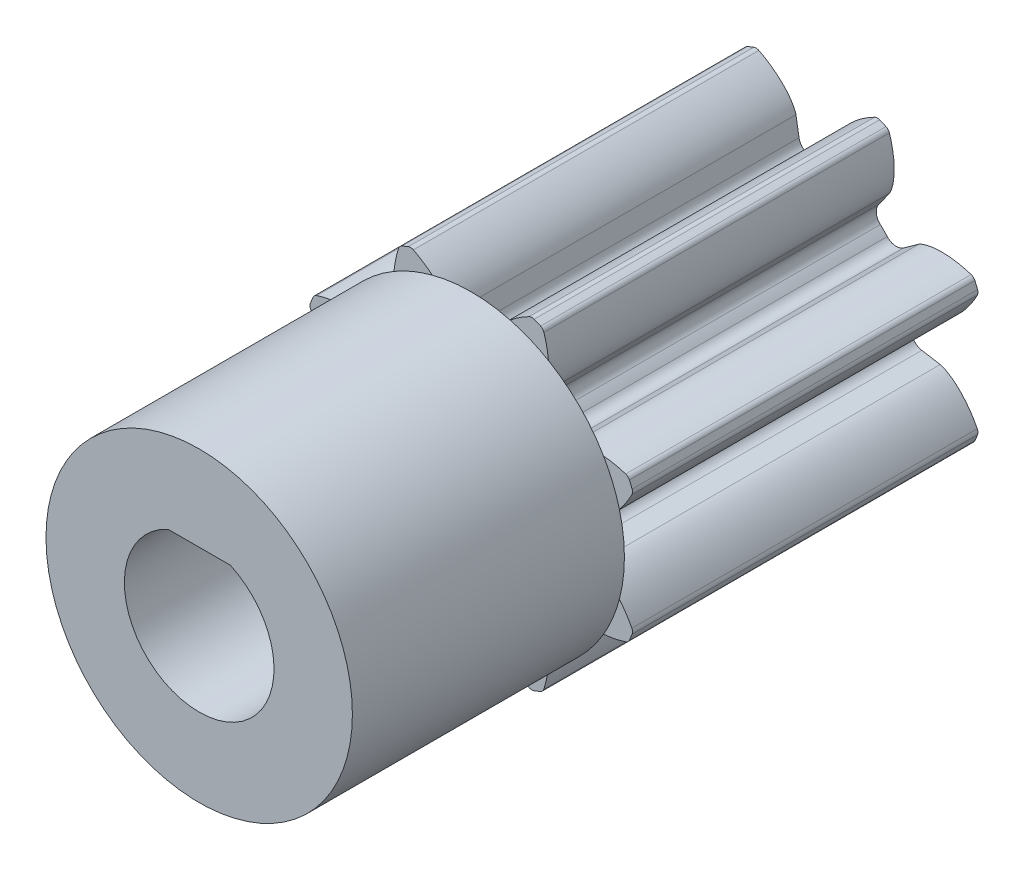
from build123d import *

# Parameters (mm, degrees)
SKETCH1_R                                 = 6.35
BOSS_EXTRUDE1_DEPTH                       = 12.7
CUT_EXTRUDE_DCLTBC_DEPTH                  = 16.554259867
FILLET_TIP_DCLTBC_R                       = 0.225840649
FILLET_ROOT_DCLTBC_R                      = 0.451681298
CIRPATTERN_DCLTBC_COUNT                   = 8
FILLET_TIP_DCLTBC_OF_CIRPATTERN_DCLTBC_R  = 0.225840649
FILLET_ROOT_DCLTBC_OF_CIRPATTERN_DCLTBC_R = 0.451681298
SKETCH4_R                                 = 5.63194408
BOSS_EXTRUDE2_DEPTH                       = 10
CUT_EXTRUDE1_DEPTH                        = 25.199542688


with BuildPart() as part:
    # Sketch1 → Boss-Extrude1 (new body)
    with BuildSketch(Plane.XY):
        Circle(SKETCH1_R)
    extrude(amount=BOSS_EXTRUDE1_DEPTH)

    # DCLTBC → Cut-Extrude-DCLTBC (cut, through all)
    with BuildSketch(Plane.XY):
        with BuildLine():
            Line((-0.762465098, 4.540469586), (-0.578384918, 3.444274544))
            ThreePointArc((-0.578384918, 3.444274544), (0, 3.4925), (0.578384918, 3.444274544))
            Line((0.578384918, 3.444274544), (0.762465098, 4.540469586))
            add(Edge.make_bspline(
                [(0.762465098, 4.540469586), (0.763034569, 4.543488036), (0.764819237, 4.551916605), (0.76893175, 4.567695247), (0.776679583, 4.593170604), (0.788064453, 4.625194838), (0.804494842, 4.666017173), (0.826031097, 4.713311361), (0.851950921, 4.764372266), (0.882541397, 4.81885718), (0.915143498, 4.872208333), (0.949571882, 4.924436701), (0.985567444, 4.975533126), (1.031137898, 5.036269094), (1.088495994, 5.107448593), (1.159378781, 5.188095877), (1.244219696, 5.276436139), (1.335260486, 5.362928889), (1.428549343, 5.445061504), (1.526869968, 5.524445472), (1.624871525, 5.598686298), (1.730580349, 5.671902497), (1.830170937, 5.737514811), (1.945834506, 5.80652891), (2.040393727, 5.860925157), (2.141307776, 5.913254628), (2.190891549, 5.938148554), (2.216425711, 5.950626611)],
                knots=[0, 0, 0, 0, 0, 0.005376748, 0.015083688, 0.02853182, 0.046610139, 0.064854849, 0.092110525, 0.119476175, 0.146842495, 0.174208853, 0.201574955, 0.228941013, 0.256307345, 0.307035032, 0.361767351, 0.41649966, 0.471231936, 0.525964281, 0.580696615, 0.635428982, 0.690161387, 0.744893688, 0.799626083, 0.854358408, 0.909090916, 0.909090916, 0.909090916, 0.909090916, 0.909090916], degree=4))
            ThreePointArc((2.216425711, 5.950626611), (0, 6.35), (-2.216425711, 5.950626611))
            add(Edge.make_bspline(
                [(-0.762465098, 4.540469586), (-0.763034569, 4.543488036), (-0.764819237, 4.551916605), (-0.76893175, 4.567695247), (-0.776679583, 4.593170604), (-0.788064453, 4.625194838), (-0.804494842, 4.666017173), (-0.826031097, 4.713311361), (-0.851950921, 4.764372266), (-0.882541397, 4.81885718), (-0.915143498, 4.872208333), (-0.949571882, 4.924436701), (-0.985567444, 4.975533126), (-1.031137898, 5.036269094), (-1.088495994, 5.107448593), (-1.159378781, 5.188095877), (-1.244219696, 5.276436139), (-1.335260486, 5.362928889), (-1.428549343, 5.445061504), (-1.526869968, 5.524445472), (-1.624871525, 5.598686298), (-1.730580349, 5.671902497), (-1.830170937, 5.737514811), (-1.945834506, 5.80652891), (-2.040393727, 5.860925157), (-2.141307776, 5.913254628), (-2.190891549, 5.938148554), (-2.216425711, 5.950626611)],
                knots=[0, 0, 0, 0, 0, 0.005376748, 0.015083688, 0.02853182, 0.046610139, 0.064854849, 0.092110525, 0.119476175, 0.146842495, 0.174208853, 0.201574955, 0.228941013, 0.256307345, 0.307035032, 0.361767351, 0.41649966, 0.471231936, 0.525964281, 0.580696615, 0.635428982, 0.690161387, 0.744893688, 0.799626083, 0.854358408, 0.909090916, 0.909090916, 0.909090916, 0.909090916, 0.909090916], degree=4))
        make_face()
    cut_extrude_dcltbc = extrude(amount=CUT_EXTRUDE_DCLTBC_DEPTH, mode=Mode.SUBTRACT)

    # Fillet-Tip-DCLTBC
    fillet_tip_dcltbc_edges = [part.edges().sort_by_distance(p)[0] for p in [
        (2.216425711, 5.950626611, 6.35),
        (-2.216425711, 5.950626611, 6.35),
    ]]
    fillet(fillet_tip_dcltbc_edges, radius=FILLET_TIP_DCLTBC_R)

    # Fillet-Root-DCLTBC
    fillet_root_dcltbc_edges = [part.edges().sort_by_distance(p)[0] for p in [
        (0.578384918, 3.444274544, 6.35),
        (-0.578384918, 3.444274544, 6.35),
    ]]
    fillet(fillet_root_dcltbc_edges, radius=FILLET_ROOT_DCLTBC_R)

    # CirPattern-DCLTBC: Cut-Extrude-DCLTBC ×8 about axis
    cirpattern_dcltbc_axis = Axis((0, 0, 12.7), (0, 0, 1))
    for i in range(1, CIRPATTERN_DCLTBC_COUNT):
        add(cut_extrude_dcltbc.rotate(cirpattern_dcltbc_axis, i * 360 / CIRPATTERN_DCLTBC_COUNT), mode=Mode.SUBTRACT)

    # Fillet-Tip-DCLTBC of CirPattern-DCLTBC
    fillet_tip_dcltbc_of_cirpattern_dcltbc_edges = [part.edges().sort_by_distance(p)[0] for p in [
        (-2.640478779, 5.77497808, 6.35),
        (-5.77497808, 2.640478779, 6.35),
        (-5.950626611, 2.216425711, 6.35),
        (-5.950626611, -2.216425711, 6.35),
        (-5.77497808, -2.640478779, 6.35),
        (-2.640478779, -5.77497808, 6.35),
        (-2.216425711, -5.950626611, 6.35),
        (2.216425711, -5.950626611, 6.35),
        (2.640478779, -5.77497808, 6.35),
        (5.77497808, -2.640478779, 6.35),
        (5.950626611, -2.216425711, 6.35),
        (5.950626611, 2.216425711, 6.35),
        (5.77497808, 2.640478779, 6.35),
        (2.640478779, 5.77497808, 6.35),
    ]]
    fillet(fillet_tip_dcltbc_of_cirpattern_dcltbc_edges, radius=FILLET_TIP_DCLTBC_OF_CIRPATTERN_DCLTBC_R)

    # Fillet-Root-DCLTBC of CirPattern-DCLTBC
    fillet_root_dcltbc_of_cirpattern_dcltbc_edges = [part.edges().sort_by_distance(p)[0] for p in [
        (-2.026489989, 2.844449784, 6.35),
        (-2.844449784, 2.026489989, 6.35),
        (-3.444274544, 0.578384918, 6.35),
        (-3.444274544, -0.578384918, 6.35),
        (-2.844449784, -2.026489989, 6.35),
        (-2.026489989, -2.844449784, 6.35),
        (-0.578384918, -3.444274544, 6.35),
        (0.578384918, -3.444274544, 6.35),
        (2.026489989, -2.844449784, 6.35),
        (2.844449784, -2.026489989, 6.35),
        (3.444274544, -0.578384918, 6.35),
        (3.444274544, 0.578384918, 6.35),
        (2.844449784, 2.026489989, 6.35),
        (2.026489989, 2.844449784, 6.35),
    ]]
    fillet(fillet_root_dcltbc_of_cirpattern_dcltbc_edges, radius=FILLET_ROOT_DCLTBC_OF_CIRPATTERN_DCLTBC_R)

    # Sketch4 → Boss-Extrude2 (add)
    with BuildSketch(Plane.XY.offset(12.7)):
        with Locations(Location((0, 0, 0), (0, 0, 165.266889092))):
            Circle(SKETCH4_R)
    extrude(amount=BOSS_EXTRUDE2_DEPTH)

    # Sketch5 → Cut-Extrude1 (cut, through all)
    with BuildSketch(Plane(origin=(0, 0, 0), x_dir=(-1, 0, 0), z_dir=(0, 0, -1))):
        with BuildLine():
            Line((1.145643924, 2.5), (-1.145643924, 2.5))
            ThreePointArc((-1.145643924, 2.5), (-1.48525742, -2.314413618), (2.75, 0))
            ThreePointArc((2.75, 0), (2.314413618, 1.48525742), (1.145643924, 2.5))
        make_face()
    extrude(amount=-CUT_EXTRUDE1_DEPTH, mode=Mode.SUBTRACT)


solid = part.part
